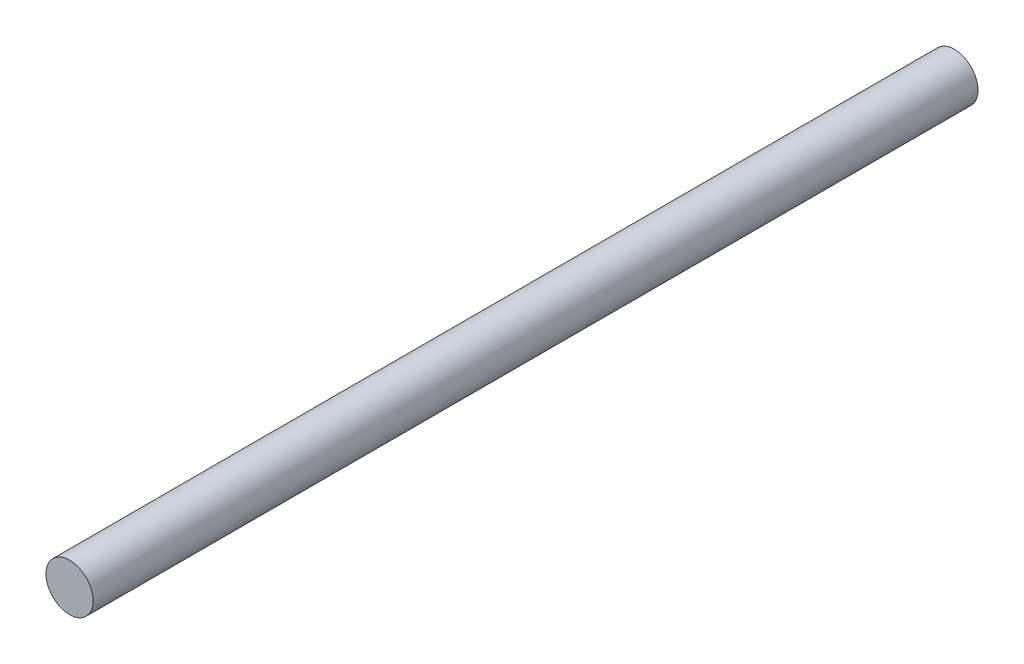
from build123d import *

# Parameters (mm, degrees)
SKIZZE1_R                       = 4
AUFSATZ_LINEAR_AUSTRAGEN1_DEPTH = 150


with BuildPart() as part:
    # Skizze1 → Aufsatz-Linear austragen1 (new body)
    with BuildSketch(Plane.XY):
        Circle(SKIZZE1_R)
    extrude(amount=AUFSATZ_LINEAR_AUSTRAGEN1_DEPTH)


solid = part.part
